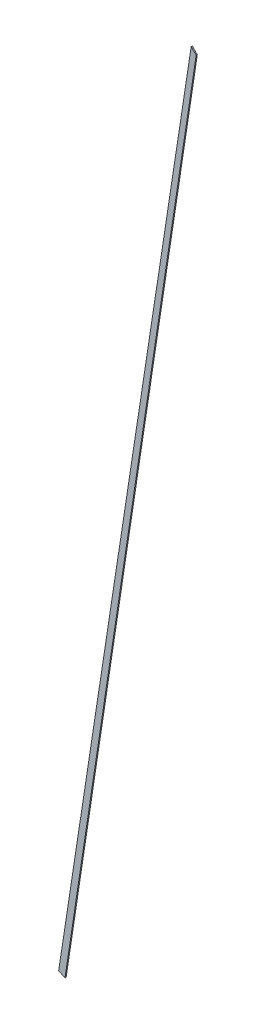
from build123d import *

# Parameters (mm, degrees)
BOSS_EXTRUDE1_DEPTH = 3.175


with BuildPart() as part:
    # Sketch2 → Boss-Extrude1 (new body)
    with BuildSketch(Plane.XY):
        Polygon((-304.535503681, -561.818435466), (-296.006484581, -566.058890417), (60.523618349, 1774.707119827), (53.788426259, 1781.442311918), align=None)
        Polygon((60.523618349, 1774.707119827), (-296.006484581, -566.058890417), (-287.477465482, -570.299345369), (67.25881044, 1767.971927737), align=None)
    extrude(amount=BOSS_EXTRUDE1_DEPTH)


solid = part.part
